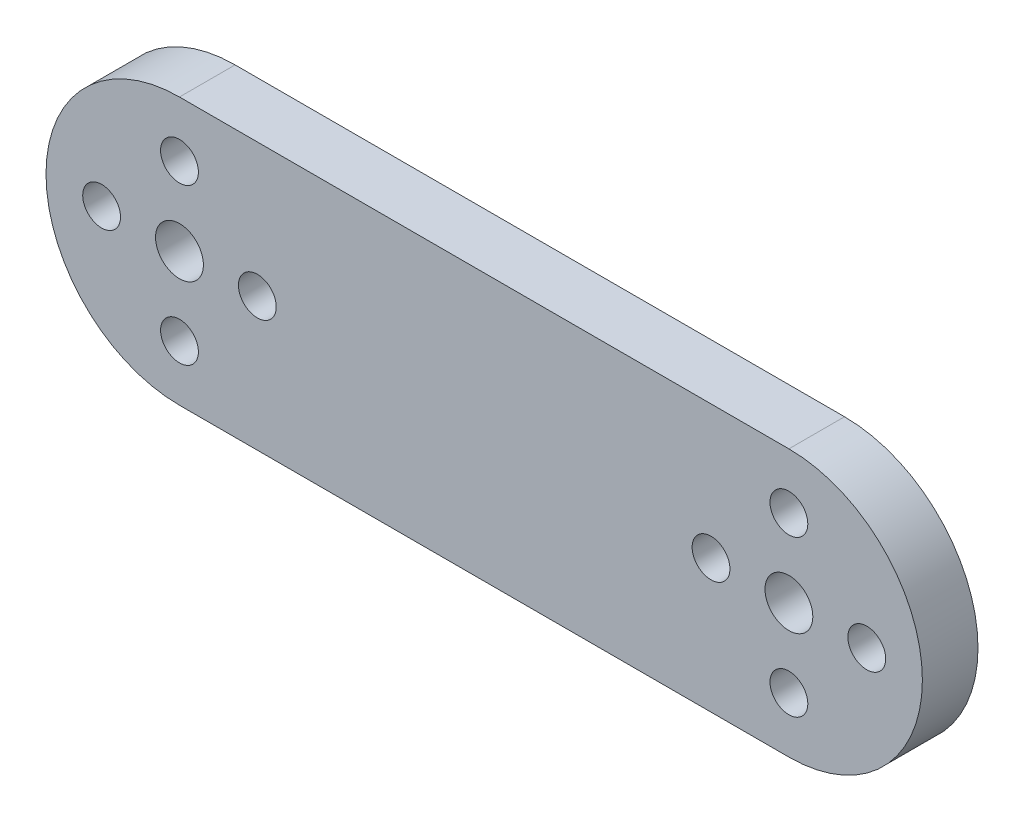
from build123d import *

# Parameters (mm, degrees)
SZKIC1_R                    = 1.7
SZKIC1_R_2                  = 2.15
DODANIE_WYCI_GNI_CIE1_DEPTH = 5


with BuildPart() as part:
    # Szkic1 → Dodanie-wyciągnięcie1 (new body)
    with BuildSketch(Plane.XY):
        with BuildLine():
            Line((0, -12), (-54.784750049, -12))
            ThreePointArc((-54.784750049, -12), (-66.784750049, 0), (-54.784750049, 12))
            Line((-54.784750049, 12), (0, 12))
            ThreePointArc((0, 12), (12, 0), (0, -12))
        make_face()
        with Locations((0, 7.001028496)):
            Circle(SZKIC1_R, mode=Mode.SUBTRACT)
        Circle(SZKIC1_R_2, mode=Mode.SUBTRACT)
        with Locations((7.001028496, 0)):
            Circle(SZKIC1_R, mode=Mode.SUBTRACT)
        with Locations((0, -7.001028496)):
            Circle(SZKIC1_R, mode=Mode.SUBTRACT)
        with Locations((-7.001028496, 0)):
            Circle(SZKIC1_R, mode=Mode.SUBTRACT)
        with Locations(Location((-47.783721554, 0, 0), (0, 0, 180))):
            Circle(SZKIC1_R, mode=Mode.SUBTRACT)
        with Locations(Location((-54.784750049, -7.001028496, 0), (0, 0, 180))):
            Circle(SZKIC1_R, mode=Mode.SUBTRACT)
        with Locations(Location((-61.785778545, 0, 0), (0, 0, 180))):
            Circle(SZKIC1_R, mode=Mode.SUBTRACT)
        with Locations(Location((-54.784750049, 0, 0), (0, 0, 180))):
            Circle(SZKIC1_R_2, mode=Mode.SUBTRACT)
        with Locations(Location((-54.784750049, 7.001028496, 0), (0, 0, 180))):
            Circle(SZKIC1_R, mode=Mode.SUBTRACT)
    extrude(amount=DODANIE_WYCI_GNI_CIE1_DEPTH)


solid = part.part
